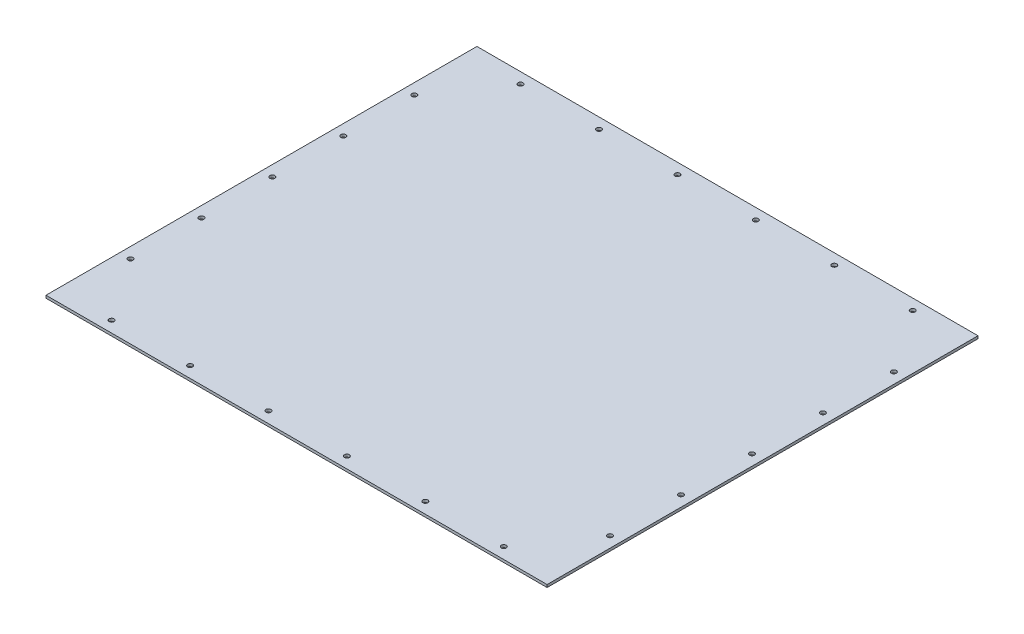
from build123d import *

# Parameters (mm, degrees)
SKETCH1_W                = 584.2
SKETCH1_H                = 502.3866
TOPPLATE_DEPTH           = 3.0734
SKETCH2_R                = 2.8956
FRONT_REARTOPHOLES_DEPTH = 386.26605061
LPATTERN1_COUNT          = 6
LPATTERN1_PITCH          = 91.44
SKETCH3_R                = 2.8956
CUT_EXTRUDE2_DEPTH       = 386.26605061
LPATTERN2_COUNT          = 5
LPATTERN2_PITCH          = 82.739099952


with BuildPart() as part:
    # Sketch1 → TopPlate (new body)
    with BuildSketch(Plane(origin=(0, 0, 0), x_dir=(1, 0, 0), z_dir=(0, 1, 0))):
        Rectangle(SKETCH1_W, SKETCH1_H)
    extrude(amount=TOPPLATE_DEPTH)

    # Sketch2 → Front/RearTopHoles (cut, through all)
    with BuildSketch(Plane(origin=(0, 3.0734, 0), x_dir=(1, 0, 0), z_dir=(0, 1, 0))):
        with Locations(Location((-228.6, 238.5949, 0), (0, 0, 270))):
            Circle(SKETCH2_R)
        with Locations(Location((-228.6, -238.208299808, 0), (0, 0, 270))):
            Circle(SKETCH2_R)
    front_reartopholes = extrude(amount=-FRONT_REARTOPHOLES_DEPTH, mode=Mode.SUBTRACT)

    # LPattern1: Front/RearTopHoles ×6
    with Locations(*[(i * LPATTERN1_PITCH, 0, 0) for i in range(1, LPATTERN1_COUNT)]):
        add(front_reartopholes, mode=Mode.SUBTRACT)

    # Sketch3 → Cut-Extrude2 (cut, through all)
    with BuildSketch(Plane(origin=(0, 3.0734, 0), x_dir=(1, 0, 0), z_dir=(0, 1, 0))):
        with Locations(Location((-279.5016, 165.6715, 0), (0, 0, 270))):
            Circle(SKETCH3_R)
        with Locations(Location((279.5016, 165.6715, 0), (0, 0, 270))):
            Circle(SKETCH3_R)
    cut_extrude2 = extrude(amount=-CUT_EXTRUDE2_DEPTH, mode=Mode.SUBTRACT)

    # LPattern2: Cut-Extrude2 ×5
    with Locations(*[(0, 0, i * LPATTERN2_PITCH) for i in range(1, LPATTERN2_COUNT)]):
        add(cut_extrude2, mode=Mode.SUBTRACT)


solid = part.part
